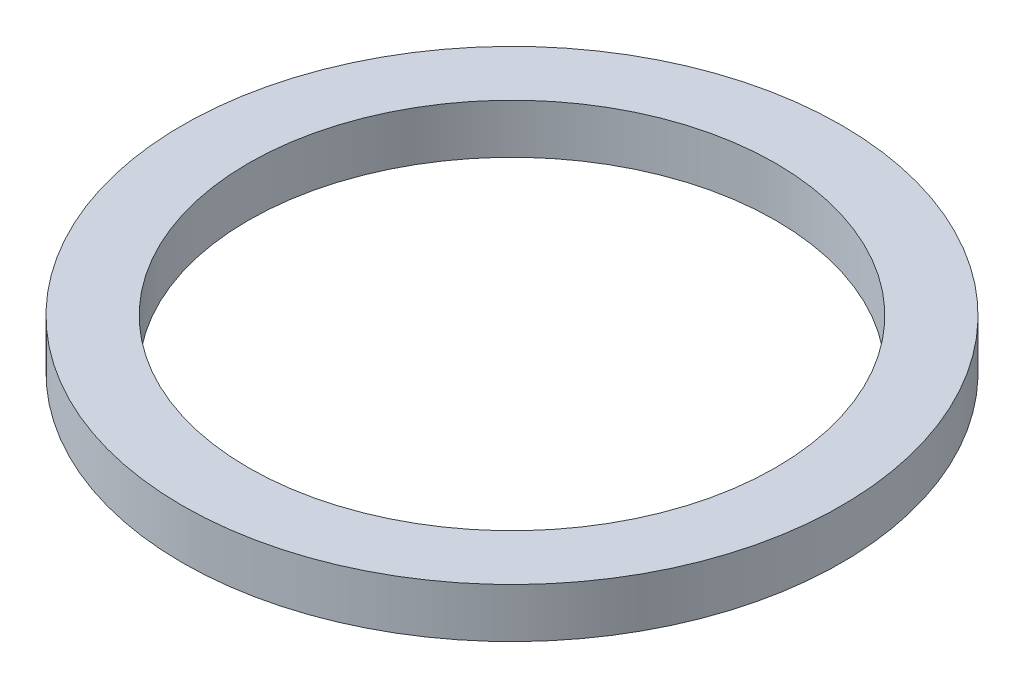
from build123d import *

# Parameters (mm, degrees)
ESQUISSE1_R        = 5
ESQUISSE1_R_2      = 4
BOSS_EXTRU_1_DEPTH = 0.75


with BuildPart() as part:
    # Esquisse1 → Boss.-Extru.1 (new body)
    with BuildSketch(Plane(origin=(0, 0, 0), x_dir=(1, 0, 0), z_dir=(0, 1, 0))):
        with Locations(Location((0, 0, 0), (0, 0, 270))):
            Circle(ESQUISSE1_R)
        with Locations(Location((0, 0, 0), (0, 0, 270))):
            Circle(ESQUISSE1_R_2, mode=Mode.SUBTRACT)
    extrude(amount=BOSS_EXTRU_1_DEPTH)


solid = part.part
